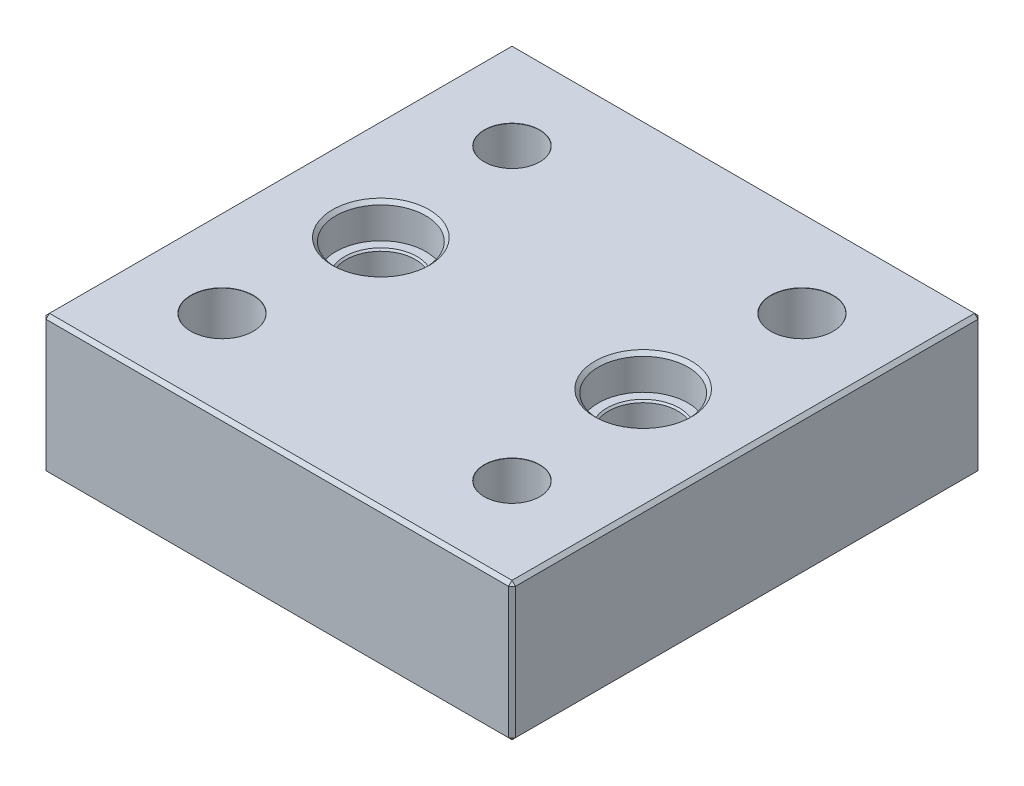
from build123d import *

# Parameters (mm, degrees)
SKETCH1_W                                    = 68
SKETCH1_H                                    = 68
BOSS_EXTRUDE1_DEPTH                          = 20
CUT_EXTRUDE1_REACH                           = 54.077
SKETCH2_R                                    = 5
SKETCH3_R                                    = 6.5
CUT_EXTRUDE2_DEPTH                           = 5
CHAMFER2_SIZE                                = 0.5
CHAMFER4_SIZE                                = 0.5
CHAMFER5_SIZE                                = 0.25
CBORE_FOR_M8_HEX_SOCKET_HEAD_CAP_SCR_2_COUNT = 2
CBORE_FOR_M8_HEX_SOCKET_HEAD_CAP_SCR_2_PITCH = 59.39696962
F_8_0MM_DOWEL_HOLE1_AT_2_COUNT               = 2
F_8_0MM_DOWEL_HOLE1_AT_2_PITCH               = 59.39696962


with BuildPart() as part:
    # Sketch1 → Boss-Extrude1 (new body)
    with BuildSketch(Plane(origin=(0, 0, 0), x_dir=(1, 0, 0), z_dir=(0, 1, 0))):
        Rectangle(SKETCH1_W, SKETCH1_H)
    extrude(amount=-BOSS_EXTRUDE1_DEPTH)

    # Sketch2 → Cut-Extrude1 (cut, up to next)
    with BuildSketch(Plane(origin=(0, 0, 0), x_dir=(1, 0, 0), z_dir=(0, 1, 0)), mode=Mode.PRIVATE) as cut_extrude1_sk1:
        with Locations(Location((-19, 0, 0), (0, 0, 270))):
            Circle(SKETCH2_R)
    cut_extrude1_tool1 = extrude(cut_extrude1_sk1.sketch, amount=-CUT_EXTRUDE1_REACH, mode=Mode.PRIVATE) & part.part
    # Sketch2 → Cut-Extrude1 (cut, up to next)
    with BuildSketch(Plane(origin=(0, 0, 0), x_dir=(1, 0, 0), z_dir=(0, 1, 0)), mode=Mode.PRIVATE) as cut_extrude1_sk2:
        with Locations(Location((19, 0, 0), (0, 0, 270))):
            Circle(SKETCH2_R)
    cut_extrude1_tool2 = extrude(cut_extrude1_sk2.sketch, amount=-CUT_EXTRUDE1_REACH, mode=Mode.PRIVATE) & part.part
    add(cut_extrude1_tool1.solids().sort_by_distance((-19, 0, 0))[0], mode=Mode.SUBTRACT)
    add(cut_extrude1_tool2.solids().sort_by_distance((19, 0, 0))[0], mode=Mode.SUBTRACT)

    # Sketch3 → Cut-Extrude2 (cut)
    with BuildSketch(Plane(origin=(0, 0, 0), x_dir=(1, 0, 0), z_dir=(0, 1, 0))):
        with Locations(Location((-19, 0, 0), (0, 0, 270))):
            Circle(SKETCH3_R)
        with Locations(Location((19, 0, 0), (0, 0, 270))):
            Circle(SKETCH3_R)
    extrude(amount=-CUT_EXTRUDE2_DEPTH, mode=Mode.SUBTRACT)

    # Chamfer2
    chamfer2_edges = [part.edges().sort_by_distance(p)[0] for p in [
        (-34, -20, 0),
        (0, -20, 34),
        (34, -20, 0),
        (0, 0, 34),
        (-34, 0, 0),
        (0, 0, -34),
        (34, 0, 0),
        (34, -10, 34),
        (-34, -10, 34),
        (-34, -10, -34),
        (34, -10, -34),
        (0, -20, -34),
    ]]
    chamfer(chamfer2_edges, length=CHAMFER2_SIZE)

    # Chamfer4
    chamfer4_edges = [part.edges().sort_by_distance(p)[0] for p in [
        (-19, 0, -6.5),
        (19, 0, -6.5),
    ]]
    chamfer(chamfer4_edges, length=CHAMFER4_SIZE)

    # Chamfer5
    chamfer5_edges = [part.edges().sort_by_distance(p)[0] for p in [
        (-19, -20, -5),
        (19, -20, -5),
        (-19, -5, -5),
        (19, -5, -5),
    ]]
    chamfer(chamfer5_edges, length=CHAMFER5_SIZE)

    # Sketch5 → CBORE for M8 Hex Socket Head Cap Screw1 (revolve, cut)
    with BuildSketch(Plane(origin=(-21, -20, 21), x_dir=(0, 0, -1), z_dir=(1, 0, 0))):
        Polygon((0, 0), (0, 20), (4.525, 20), (4.5, 19.975), (4.5, 8.6), (7.5, 8.6), (7.5, 0.025), (7.525, 0), align=None)
    cbore_for_m8_hex_socket_head_cap_screw1 = revolve(axis=Axis((-21, -26.35, 21), (0, 1, 0)), mode=Mode.SUBTRACT)

    # CBORE for M8 Hex Socket Head Cap Scr 2: CBORE for M8 Hex Socket Head Cap Screw1 ×2
    with Locations(*[Vector(0.7071067811865476, 0, -0.7071067811865476) * (i * CBORE_FOR_M8_HEX_SOCKET_HEAD_CAP_SCR_2_PITCH) for i in range(1, CBORE_FOR_M8_HEX_SOCKET_HEAD_CAP_SCR_2_COUNT)]):
        add(cbore_for_m8_hex_socket_head_cap_screw1, mode=Mode.SUBTRACT)

    # Sketch7 → Ø8.0mm Dowel Hole1 (revolve, cut)
    with BuildSketch(Plane(origin=(-21, -20, -21), x_dir=(0, 0, -1), z_dir=(1, 0, 0))):
        Polygon((0, 0), (0, 20), (4.025, 20), (4, 19.975), (4, 0.025), (4.025, 0), align=None)
    f_8_0mm_dowel_hole1 = revolve(axis=Axis((-21, -26.35, -21), (0, 1, 0)), mode=Mode.SUBTRACT)

    # Ø8.0mm Dowel Hole1 at 2: Ø8.0mm Dowel Hole1 ×2
    with Locations(*[Vector(0.7071067811865476, 0, 0.7071067811865476) * (i * F_8_0MM_DOWEL_HOLE1_AT_2_PITCH) for i in range(1, F_8_0MM_DOWEL_HOLE1_AT_2_COUNT)]):
        add(f_8_0mm_dowel_hole1, mode=Mode.SUBTRACT)


solid = part.part
